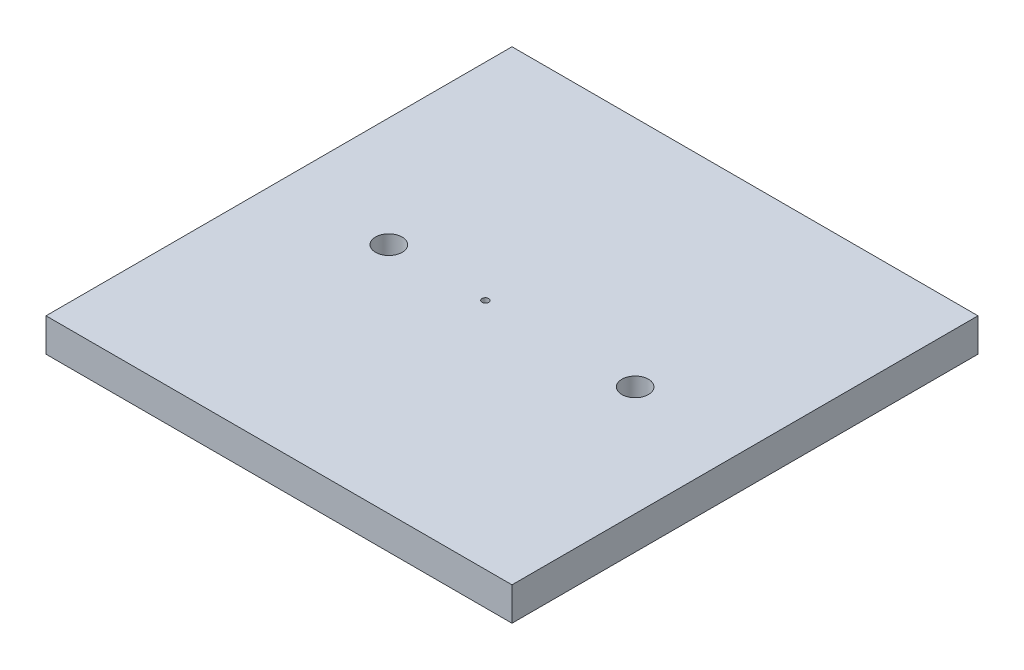
from build123d import *

# Parameters (mm, degrees)
SKETCH1_W           = 70
SKETCH1_H           = 70
BOSS_EXTRUDE1_DEPTH = 5
SKETCH2_R           = 25.5
SKETCH2_R_2         = 2
CUT_EXTRUDE3_DEPTH  = 2
SKETCH3_R           = 2
CUT_EXTRUDE4_DEPTH  = 10
SKETCH4_R           = 2
CUT_EXTRUDE5_DEPTH  = 10
SKETCH5_R           = 0.5
CUT_EXTRUDE7_DEPTH  = 10


with BuildPart() as part:
    # Sketch1 → Boss-Extrude1 (new body)
    with BuildSketch(Plane(origin=(0, 0, 0), x_dir=(1, 0, 0), z_dir=(0, 1, 0))):
        Rectangle(SKETCH1_W, SKETCH1_H)
    extrude(amount=BOSS_EXTRUDE1_DEPTH)

    # Sketch2 → Cut-Extrude3 (cut)
    with BuildSketch(Plane.XZ):
        with Locations(Location((0, 0, 0), (0, 0, 270))):
            Circle(SKETCH2_R)
        with Locations(Location((-18.5, 0, 0), (0, 0, 270))):
            Circle(SKETCH2_R_2, mode=Mode.SUBTRACT)
        with Locations(Location((18.5, 0, 0), (0, 0, 90))):
            Circle(SKETCH2_R_2, mode=Mode.SUBTRACT)
    extrude(amount=-CUT_EXTRUDE3_DEPTH, mode=Mode.SUBTRACT)

    # Sketch3 → Cut-Extrude4 (cut)
    with BuildSketch(Plane.XZ):
        with Locations(Location((18.5, 0, 0), (0, 0, 270))):
            Circle(SKETCH3_R)
    extrude(amount=-CUT_EXTRUDE4_DEPTH, mode=Mode.SUBTRACT)

    # Sketch4 → Cut-Extrude5 (cut)
    with BuildSketch(Plane(origin=(0, 0, 0), x_dir=(-1, 0, 0), z_dir=(0, -1, 0))):
        with Locations(Location((18.5, 0, 0), (0, 0, 90))):
            Circle(SKETCH4_R)
    extrude(amount=-CUT_EXTRUDE5_DEPTH, mode=Mode.SUBTRACT)

    # Sketch5 → Cut-Extrude7 (cut)
    with BuildSketch(Plane(origin=(0, 2, 0), x_dir=(-1, 0, 0), z_dir=(0, -1, 0))):
        with Locations(Location((4, 0, 0), (0, 0, 90))):
            Circle(SKETCH5_R)
    extrude(amount=-CUT_EXTRUDE7_DEPTH, mode=Mode.SUBTRACT)


solid = part.part
